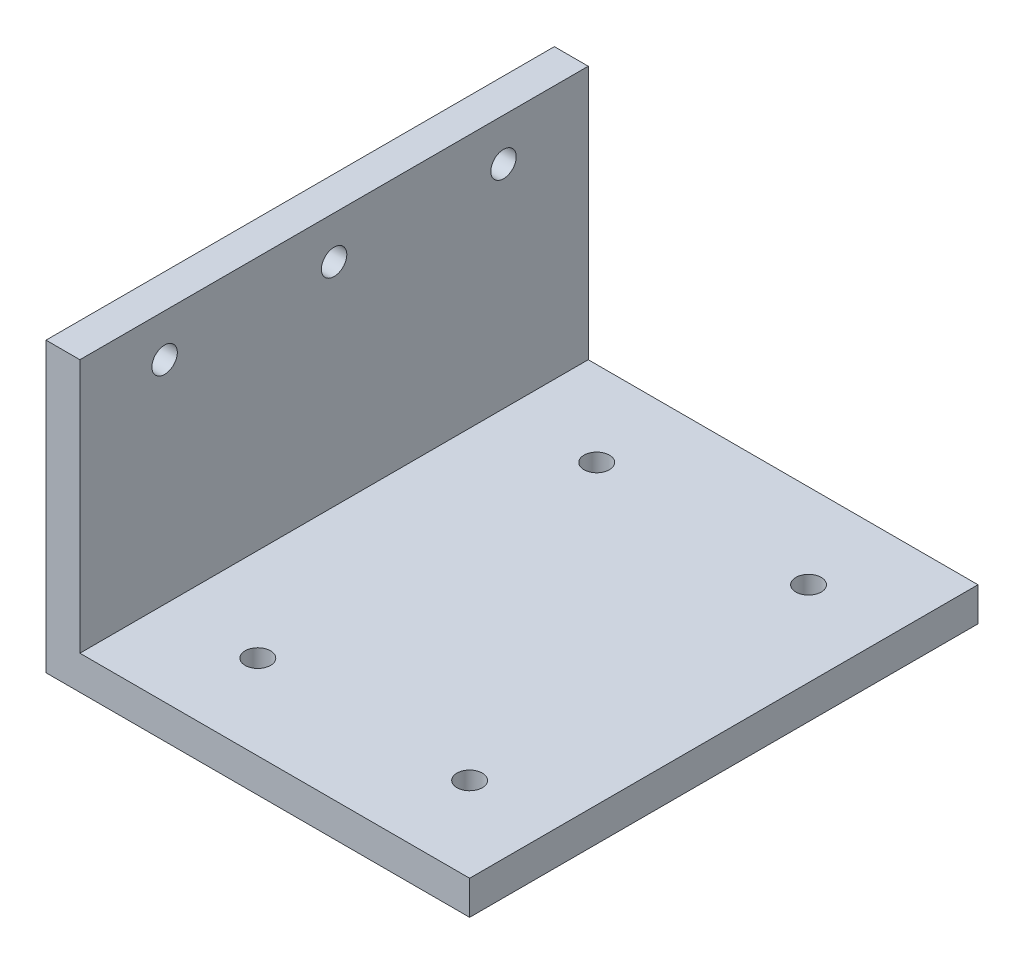
from build123d import *

# Parameters (mm, degrees)
EXTRUSION1_DEPTH                = 60
ESQUISSE2_R                     = 1.5
EXTRUSION2_DEPTH                = 91.642153549
R_P_TITION_LIN_AIRE1_COUNT      = 2
R_P_TITION_LIN_AIRE1_PITCH      = 40
R_P_TITION_LIN_AIRE1_COUNT_DIR2 = 2
R_P_TITION_LIN_AIRE1_PITCH_DIR2 = 25
ESQUISSE3_W                     = 123.67499348
ESQUISSE3_H                     = 39.653502897
EXTRUSION3_DEPTH                = 10
ESQUISSE4_R                     = 1.5
EXTRUSION4_DEPTH                = 10
R_P_TITION_LIN_AIRE2_COUNT      = 3
R_P_TITION_LIN_AIRE2_PITCH      = 20


with BuildPart() as part:
    # Esquisse1 → Extrusion1 (new body)
    with BuildSketch(Plane.XY):
        Polygon((0, 0), (4, 0), (50, 0), (50, 4), (4, 4), (4, 50), (0, 50), align=None)
    extrude(amount=EXTRUSION1_DEPTH)

    # Esquisse2 → Extrusion2 (cut, through all)
    with BuildSketch(Plane(origin=(0, 4, 0), x_dir=(1, 0, 0), z_dir=(0, 1, 0))):
        with Locations(Location((40, -50, 0), (0, 0, 270))):
            Circle(ESQUISSE2_R)
    extrusion2 = extrude(amount=-EXTRUSION2_DEPTH, mode=Mode.SUBTRACT)

    # Répétition linéaire1: Extrusion2 2 × 2
    with Locations(*[(-j * R_P_TITION_LIN_AIRE1_PITCH_DIR2, 0, -i * R_P_TITION_LIN_AIRE1_PITCH) for i in range(R_P_TITION_LIN_AIRE1_COUNT) for j in range(R_P_TITION_LIN_AIRE1_COUNT_DIR2) if (i, j) != (0, 0)]):
        add(extrusion2, mode=Mode.SUBTRACT)

    # Esquisse3 → Extrusion3 (cut)
    with BuildSketch(Plane.ZY):
        with Locations((37.763783115, 53.826751449)):
            Rectangle(ESQUISSE3_W, ESQUISSE3_H)
    extrude(amount=-EXTRUSION3_DEPTH, mode=Mode.SUBTRACT)

    # Esquisse4 → Extrusion4 (cut)
    with BuildSketch(Plane.ZY):
        with Locations((50, 29)):
            Circle(ESQUISSE4_R)
    extrusion4 = extrude(amount=-EXTRUSION4_DEPTH, mode=Mode.SUBTRACT)

    # Répétition linéaire2: Extrusion4 ×3
    with Locations(*[(0, 0, -i * R_P_TITION_LIN_AIRE2_PITCH) for i in range(1, R_P_TITION_LIN_AIRE2_COUNT)]):
        add(extrusion4, mode=Mode.SUBTRACT)


solid = part.part
